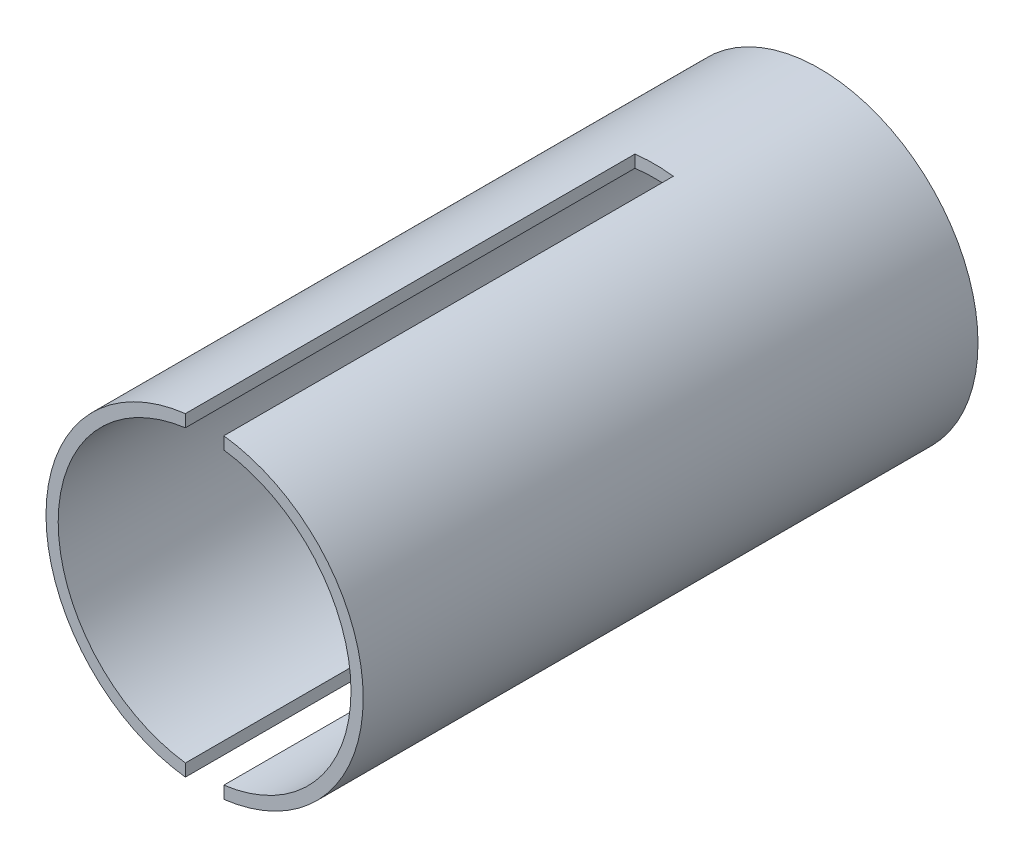
from build123d import *

# Parameters (mm, degrees)
SKETCH1_R           = 41.275
SKETCH1_R_2         = 38.1
BOSS_EXTRUDE1_DEPTH = 160
SKETCH2_W           = 10
SKETCH2_H           = 60
CUT_EXTRUDE1_DEPTH  = 50
SKETCH3_W           = 10
SKETCH3_H           = 117
CUT_EXTRUDE2_DEPTH  = 50


with BuildPart() as part:
    # Sketch1 → Boss-Extrude1 (new body)
    with BuildSketch(Plane.XY):
        Circle(SKETCH1_R)
        Circle(SKETCH1_R_2, mode=Mode.SUBTRACT)
    extrude(amount=BOSS_EXTRUDE1_DEPTH)

    # Sketch2 → Cut-Extrude1 (cut)
    with BuildSketch(Plane(origin=(0, 0, 0), x_dir=(1, 0, 0), z_dir=(0, 1, 0))):
        with Locations((0, -130)):
            Rectangle(SKETCH2_W, SKETCH2_H)
    extrude(amount=-CUT_EXTRUDE1_DEPTH, mode=Mode.SUBTRACT)

    # Sketch3 → Cut-Extrude2 (cut)
    with BuildSketch(Plane(origin=(0, 0, 0), x_dir=(1, 0, 0), z_dir=(0, 1, 0))):
        with Locations((0, -101.5)):
            Rectangle(SKETCH3_W, SKETCH3_H)
    extrude(amount=CUT_EXTRUDE2_DEPTH, mode=Mode.SUBTRACT)


solid = part.part
